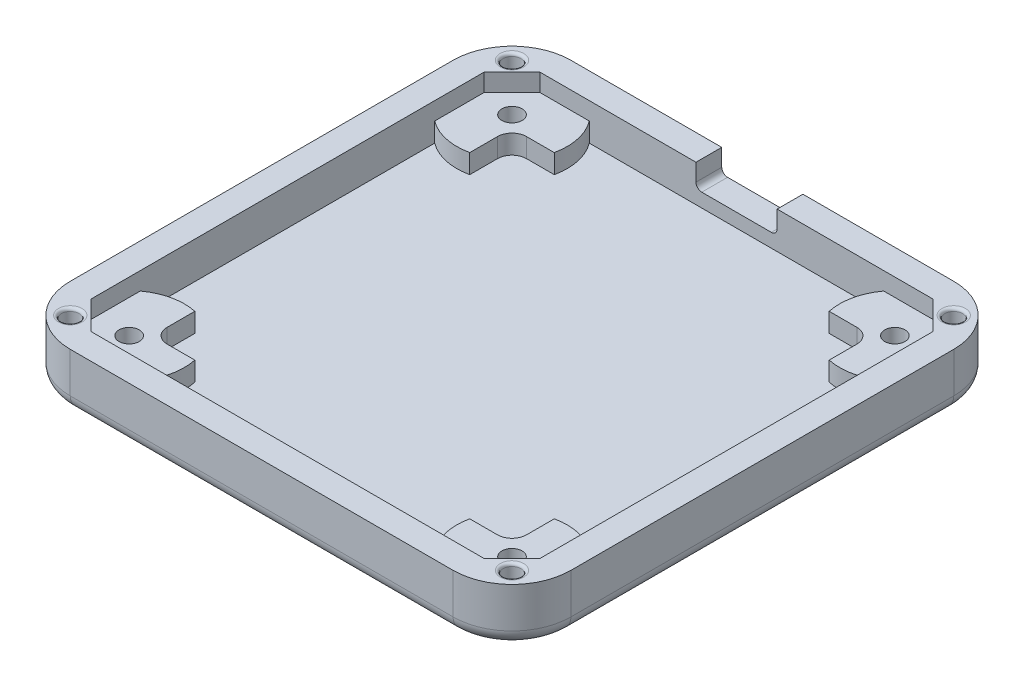
from build123d import *

# Parameters (mm, degrees)
BOSS_EXTRUDE1_DEPTH     = 24.9936
CUT_EXTRUDE1_DEPTH      = 20
SKETCH5_W               = 92.738858464
SKETCH5_H               = 19.900213379
CUT_EXTRUDE2_DEPTH      = 127
CUT_EXTRUDE3_DEPTH      = 6.35
SKETCH8_R               = 9.525
BOSS_EXTRUDE2_DEPTH     = 3.302
FILLET2_R               = 2.54
SKETCH9_R               = 1.74879
CUT_EXTRUDE4_DEPTH      = 15.6972
SKETCH10_R              = 3.25
CUT_EXTRUDE5_DEPTH      = 4
SKETCH11_R              = 1.524
CUT_EXTRUDE6_DEPTH      = 5.08
MIRROR2_COPY_1_SKETCH_R = 1.524
MIRROR2_COPY_1_DEPTH    = 5.08
FILLET3_R               = 0.508
CUT_EXTRUDE7_DEPTH      = 3.302
FILLET5_R               = 1


with BuildPart() as part:
    # Sketch1 → Boss-Extrude1 (new body)
    with BuildSketch(Plane(origin=(0, 0, 0), x_dir=(1, 0, 0), z_dir=(0, 1, 0))):
        with BuildLine():
            Line((-33.02, 43.18), (33.02, 43.18))
            ThreePointArc((33.02, 43.18), (40.204204897, 40.204204897), (43.18, 33.02))
            Line((43.18, 33.02), (43.18, -33.02))
            ThreePointArc((43.18, -33.02), (40.204204897, -40.204204897), (33.02, -43.18))
            Line((33.02, -43.18), (-33.02, -43.18))
            ThreePointArc((-33.02, -43.18), (-40.204204897, -40.204204897), (-43.18, -33.02))
            Line((-43.18, -33.02), (-43.18, 33.02))
            ThreePointArc((-43.18, 33.02), (-40.204204897, 40.204204897), (-33.02, 43.18))
        make_face()
    extrude(amount=BOSS_EXTRUDE1_DEPTH)

    # Sketch2 → Cut-Extrude1 (cut)
    with BuildSketch(Plane(origin=(0, 0, -43.18), x_dir=(-1, 0, 0), z_dir=(0, 0, -1))):
        Polygon((-7, 8.0264), (-7, 5.5264), (7, 5.5264), (7, 8.0264), (7, 12.5264), (-7, 12.5264), align=None)
    extrude(amount=-CUT_EXTRUDE1_DEPTH, mode=Mode.SUBTRACT)

    # Sketch5 → Cut-Extrude2 (cut)
    with BuildSketch(Plane(origin=(0, 0, -43.18), x_dir=(-1, 0, 0), z_dir=(0, 0, -1))):
        with Locations((0, 19.452214385)):
            Rectangle(SKETCH5_W, SKETCH5_H)
    extrude(amount=-CUT_EXTRUDE2_DEPTH, mode=Mode.SUBTRACT)

    # Sketch7 → Cut-Extrude3 (cut)
    with BuildSketch(Plane(origin=(0, 9.502107695, 0), x_dir=(1, 0, 0), z_dir=(0, 1, 0))):
        Polygon((-38.735, 33.909), (-33.909, 38.735), (33.909, 38.735), (38.735, 33.909), (38.735, -33.909), (33.909, -38.735), (-33.909, -38.735), (-38.735, -33.909), align=None)
    extrude(amount=-CUT_EXTRUDE3_DEPTH, mode=Mode.SUBTRACT)

    # Sketch8 → Boss-Extrude2 (add)
    with BuildSketch(Plane(origin=(0, 3.152107695, 0), x_dir=(1, 0, 0), z_dir=(0, 1, 0))):
        with Locations((-33.02, 33.02)):
            Circle(SKETCH8_R)
        with Locations((33.02, 33.02)):
            Circle(SKETCH8_R)
        with Locations((-33.02, -33.02)):
            Circle(SKETCH8_R)
        with Locations((33.02, -33.02)):
            Circle(SKETCH8_R)
    extrude(amount=BOSS_EXTRUDE2_DEPTH)

    # Fillet2
    fillet2_edges = [part.edges().sort_by_distance(p)[0] for p in [
        (0, 0, 43.18),
        (-40.204204897, 0, 40.204204897),
        (-43.18, 0, 0),
        (-40.204204897, 0, -40.204204897),
        (0, 0, -43.18),
        (40.204204897, 0, -40.204204897),
        (43.18, 0, 0),
        (40.204204897, 0, 40.204204897),
    ]]
    fillet(fillet2_edges, radius=FILLET2_R)

    # Sketch9 → Cut-Extrude4 (cut)
    with BuildSketch(Plane(origin=(0, 6.454107695, 0), x_dir=(1, 0, 0), z_dir=(0, 1, 0))):
        with Locations(Location((-33.02, 33.02, 0), (0, 0, 270))):
            Circle(SKETCH9_R)
        with Locations(Location((33.02, 33.02, 0), (0, 0, 270))):
            Circle(SKETCH9_R)
        with Locations(Location((-33.02, -33.02, 0), (0, 0, 270))):
            Circle(SKETCH9_R)
        with Locations(Location((33.02, -33.02, 0), (0, 0, 270))):
            Circle(SKETCH9_R)
    extrude(amount=-CUT_EXTRUDE4_DEPTH, mode=Mode.SUBTRACT)

    # Sketch10 → Cut-Extrude5 (cut)
    with BuildSketch(Plane.XZ):
        with Locations(Location((-33.02, -33.02, 0), (0, 0, 270))):
            Circle(SKETCH10_R)
        with Locations(Location((-33.02, 33.02, 0), (0, 0, 270))):
            Circle(SKETCH10_R)
        with Locations(Location((33.02, 33.02, 0), (0, 0, 270))):
            Circle(SKETCH10_R)
        with Locations(Location((33.02, -33.02, 0), (0, 0, 270))):
            Circle(SKETCH10_R)
    extrude(amount=-CUT_EXTRUDE5_DEPTH, mode=Mode.SUBTRACT)

    # Sketch11 → Cut-Extrude6 (cut)
    with BuildSketch(Plane(origin=(0, 9.502107695, 0), x_dir=(1, 0, 0), z_dir=(0, 1, 0))):
        with Locations(Location((-38.1, 38.1, 0), (0, 0, 270))):
            Circle(SKETCH11_R)
    cut_extrude6 = extrude(amount=-CUT_EXTRUDE6_DEPTH, mode=Mode.SUBTRACT)

    # Mirror1: Cut-Extrude6 across plane
    add(cut_extrude6.mirror(Plane(origin=(0, 0, 0), x_dir=(0, 0, 1), z_dir=(1, 0, 0))), mode=Mode.SUBTRACT)

    # Mirror2: Cut-Extrude6 across plane
    add(cut_extrude6.mirror(Plane.XY), mode=Mode.SUBTRACT)

    # Mirror2 copy 1 sketch → Mirror2 copy 1 (cut)
    with BuildSketch(Plane(origin=(0, 9.502107695, 0), x_dir=(-1, 0, 0), z_dir=(0, 1, 0))):
        with Locations(Location((-38.1, 38.1, 0), (0, 0, 270))):
            Circle(MIRROR2_COPY_1_SKETCH_R)
    extrude(amount=-MIRROR2_COPY_1_DEPTH, mode=Mode.SUBTRACT)

    # Fillet3
    fillet3_edges = [part.edges().sort_by_distance(p)[0] for p in [
        (-38.1, 9.502107695, -39.624),
        (38.1, 9.502107695, -39.624),
        (-38.1, 9.502107695, 39.624),
        (38.1, 9.502107695, 39.624),
    ]]
    fillet(fillet3_edges, radius=FILLET3_R)

    # Sketch12 → Cut-Extrude7 (cut)
    with BuildSketch(Plane(origin=(0, 6.454107695, 0), x_dir=(1, 0, 0), z_dir=(0, 1, 0))):
        with BuildLine():
            Line((28.5, -31), (-28.5, -31))
            ThreePointArc((-28.5, -31), (-30.267766953, -30.267766953), (-31, -28.5))
            Line((-31, -28.5), (-31, 28.5))
            ThreePointArc((-31, 28.5), (-30.267766953, 30.267766953), (-28.5, 31))
            Line((-28.5, 31), (28.5, 31))
            ThreePointArc((28.5, 31), (30.267766953, 30.267766953), (31, 28.5))
            Line((31, 28.5), (31, -28.5))
            ThreePointArc((31, -28.5), (30.267766953, -30.267766953), (28.5, -31))
        make_face()
    extrude(amount=-CUT_EXTRUDE7_DEPTH, mode=Mode.SUBTRACT)

    # Fillet5
    fillet5_edges = [part.edges().sort_by_distance(p)[0] for p in [
        (7, 5.5264, -40.9575),
        (-7, 5.5264, -40.9575),
    ]]
    fillet(fillet5_edges, radius=FILLET5_R)


solid = part.part
